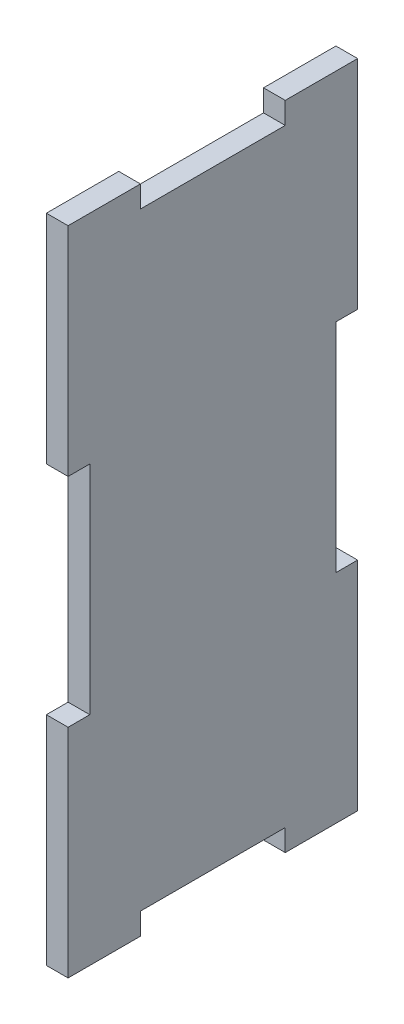
from build123d import *

# Parameters (mm, degrees)
BOSS_EXTRU_1_DEPTH = 3


with BuildPart() as part:
    # Esquisse1 → Boss.-Extru.1 (new body)
    with BuildSketch(Plane(origin=(0, 0, 0), x_dir=(0, 0, -1), z_dir=(1, 0, 0))):
        Polygon((-7, 31.923632763), (3, 31.923632763), (3, 1.923632763), (0, 1.923632763), (0, -28.076367237), (3, -28.076367237), (3, -58.076367237), (-7, -58.076367237), (-7, -55.076367237), (-27, -55.076367237), (-27, -58.076367237), (-37, -58.076367237), (-37, -28.076367237), (-34, -28.076367237), (-34, 1.923632763), (-37, 1.923632763), (-37, 31.923632763), (-27, 31.923632763), (-27, 28.923632763), (-7, 28.923632763), align=None)
    extrude(amount=BOSS_EXTRU_1_DEPTH)


solid = part.part
